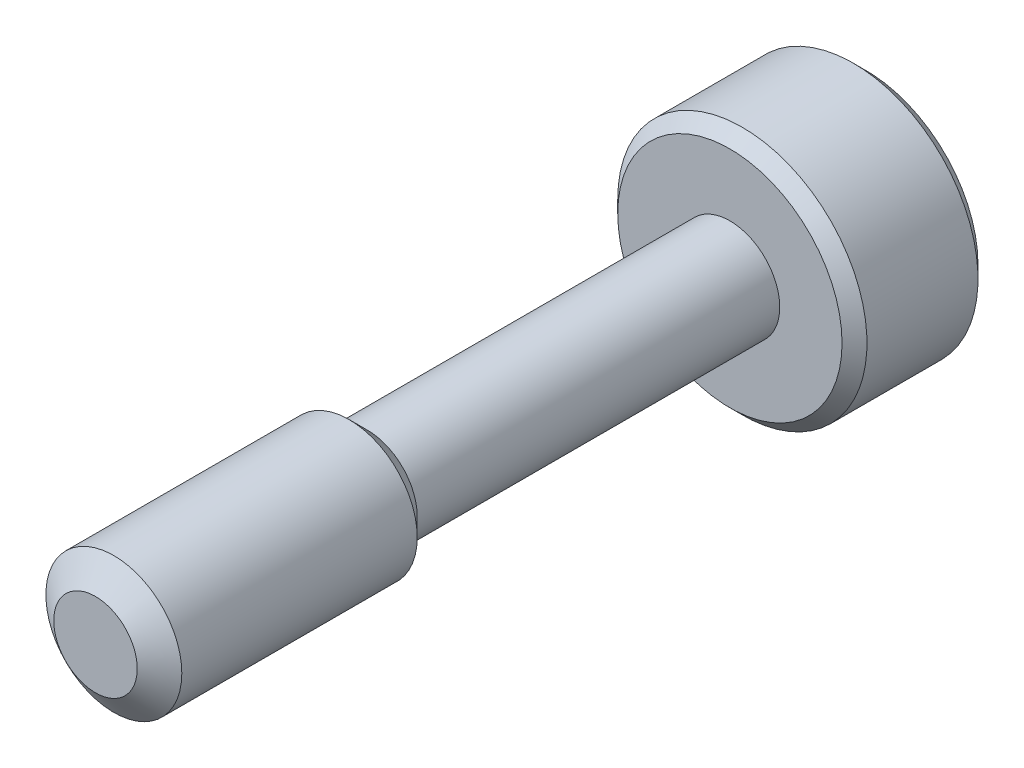
from build123d import *

# Parameters (mm, degrees)
SKETCH1_R          = 1.5
EXTRUDE1_DEPTH     = 14
SKETCH6_R          = 2.75
EXTRUDE2_DEPTH     = 3
CUT_EXTRUDE1_DEPTH = 1.875
CHAMFER1_SIZE      = 0.275
SKETCH11_OUTSIDE_W = 11.238
SKETCH11_OUTSIDE_H = 11.238
SKETCH11_OUTSIDE_R = 1.1
CUT_EXTRUDE3_DEPTH = 8


with BuildPart() as part:
    # Sketch1 → Extrude1 (new body)
    with BuildSketch(Plane.XY):
        Circle(SKETCH1_R)
    extrude(amount=-EXTRUDE1_DEPTH)

    # Sketch6 → Extrude2 (add)
    with BuildSketch(Plane(origin=(0, 0, -14), x_dir=(-1, 0, 0), z_dir=(0, 0, -1))):
        Circle(SKETCH6_R)
    extrude(amount=EXTRUDE2_DEPTH)

    # Sketch7 → Cut-Extrude1 (cut)
    with BuildSketch(Plane(origin=(0, 0, -17), x_dir=(-1, 0, 0), z_dir=(0, 0, -1))):
        Polygon((0, 1.443375673), (-1.25, 0.721687836), (-1.25, -0.721687836), (0, -1.443375673), (1.25, -0.721687836), (1.25, 0.721687836), align=None)
    extrude(amount=-CUT_EXTRUDE1_DEPTH, mode=Mode.SUBTRACT)

    # Cut-Extrude2 cone 1 section (through the dimple's axis) → Cut-Extrude2 (revolve, cut)
    with BuildSketch(Plane(origin=(0, 0, -17), x_dir=(0, 1, 0), z_dir=(1, 0, 0))):
        Polygon((0, 0), (1.443375673, 0), (0, 1.443375673), align=None)
    revolve(axis=Axis((0, 0, -17), (0, 0, 1)), mode=Mode.SUBTRACT)

    # Chamfer1
    chamfer1_edges = [part.edges().sort_by_distance(p)[0] for p in [
        (2.75, 0, -17),
        (2.75, 0, -14),
    ]]
    chamfer(chamfer1_edges, length=CHAMFER1_SIZE)

    # Sketch11 outside → Cut-Extrude3 (cut)
    with BuildSketch(Plane.XY.offset(-14)):
        Rectangle(SKETCH11_OUTSIDE_W, SKETCH11_OUTSIDE_H)
        Circle(SKETCH11_OUTSIDE_R, mode=Mode.SUBTRACT)
    extrude(amount=CUT_EXTRUDE3_DEPTH, mode=Mode.SUBTRACT)

    # Sketch4 → Cut-Revolve1 (revolve, cut)
    with BuildSketch(Plane(origin=(0, 0, 0), x_dir=(0, 0, -1), z_dir=(1, 0, 0))):
        Polygon((0.405251783, 1.5), (0, 0.921240474), (0, 1.5), align=None)
        Polygon((5.6, 1.5), (6, 1.5), (6, 1.1), align=None)
    revolve(axis=Axis((0, 0, 0), (0, 0, -1)), mode=Mode.SUBTRACT)


solid = part.part
